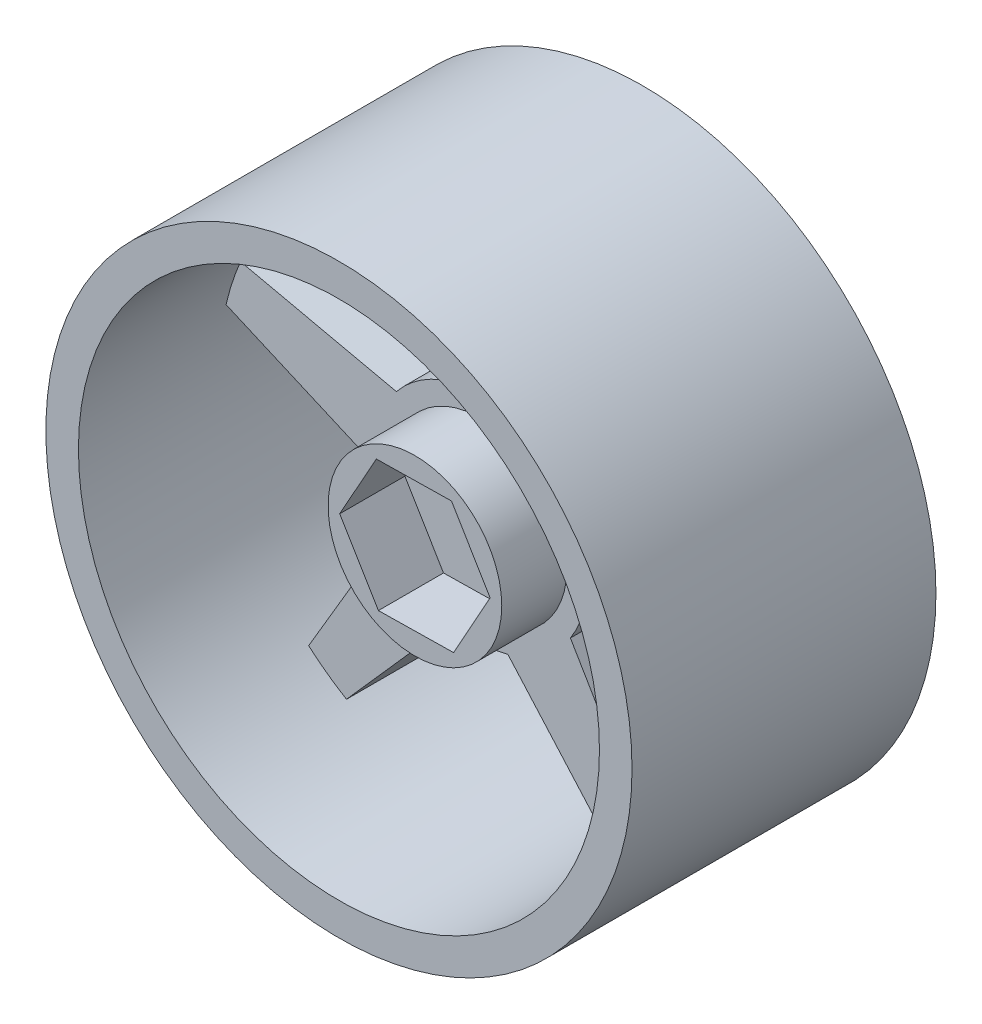
from build123d import *

# Parameters (mm, degrees)
SKETCH_1_R      = 27
SKETCH_1_R_2    = 24
EXTRUDE_1_DEPTH = 28
EXTRUDE_2_DEPTH = 15
SKETCH_3_R      = 8
EXTRUDE_3_DEPTH = 6
SKETCH_4_R      = 17.5
EXTRUDE_4_DEPTH = 6


with BuildPart() as part:
    # 草图1 → 凸台-拉伸1 (new body)
    with BuildSketch(Plane.XY):
        Circle(SKETCH_1_R)
        Circle(SKETCH_1_R_2, mode=Mode.SUBTRACT)
    extrude(amount=EXTRUDE_1_DEPTH)

    # 草图2 → 凸台-拉伸2 (add)
    with BuildSketch(Plane.XY):
        with BuildLine():
            Line((-2, 25.5), (-3.56, 9.26))
            ThreePointArc((-3.56, 9.26), (-5.831268155, 8.026052062), (-7.706682841, 6.247258566))
            Line((-7.706682841, 6.247258566), (-23.633907177, 9.782046389))
            Line((-23.633907177, 9.782046389), (-24.869975154, 5.977820324))
            Line((-24.869975154, 5.977820324), (-9.906883841, -0.52426383))
            ThreePointArc((-9.906883841, -0.52426383), (-9.435190072, -3.065679092), (-8.322991936, -5.39898187))
            Line((-8.322991936, -5.39898187), (-16.606557922, -19.454362852))
            Line((-16.606557922, -19.454362852), (-13.370489945, -21.805503861))
            Line((-13.370489945, -21.805503861), (-2.562790936, -9.584012866))
            ThreePointArc((-2.562790936, -9.584012866), (0, -9.92074594), (2.562790936, -9.584012866))
            Line((2.562790936, -9.584012866), (13.370489945, -21.805503861))
            Line((13.370489945, -21.805503861), (16.606557922, -19.454362852))
            Line((16.606557922, -19.454362852), (8.322991936, -5.39898187))
            ThreePointArc((8.322991936, -5.39898187), (9.435190072, -3.065679092), (9.906883841, -0.52426383))
            Line((9.906883841, -0.52426383), (24.869975154, 5.977820324))
            Line((24.869975154, 5.977820324), (23.633907177, 9.782046389))
            Line((23.633907177, 9.782046389), (7.706682841, 6.247258566))
            ThreePointArc((7.706682841, 6.247258566), (5.831268155, 8.026052062), (3.56, 9.26))
            Line((3.56, 9.26), (2, 25.5))
            Line((2, 25.5), (-2, 25.5))
        make_face()
    extrude(amount=EXTRUDE_2_DEPTH)

    # 草图3 → 凸台-拉伸3 (add)
    with BuildSketch(Plane.XY.offset(15)):
        Circle(SKETCH_3_R)
        Polygon((3.560842768, -5.943096733), (6.927294132, 0.11223193), (3.366451364, 6.055328663), (-3.560842768, 5.943096733), (-6.927294132, -0.11223193), (-3.366451364, -6.055328663), align=None, mode=Mode.SUBTRACT)
    extrude(amount=EXTRUDE_3_DEPTH)

    # 草图4 → 凸台-拉伸4 (add)
    with BuildSketch(Plane(origin=(0, 0, 0), x_dir=(-1, 0, 0), z_dir=(0, 0, -1))):
        Circle(SKETCH_4_R)
    extrude(amount=-EXTRUDE_4_DEPTH)


solid = part.part
